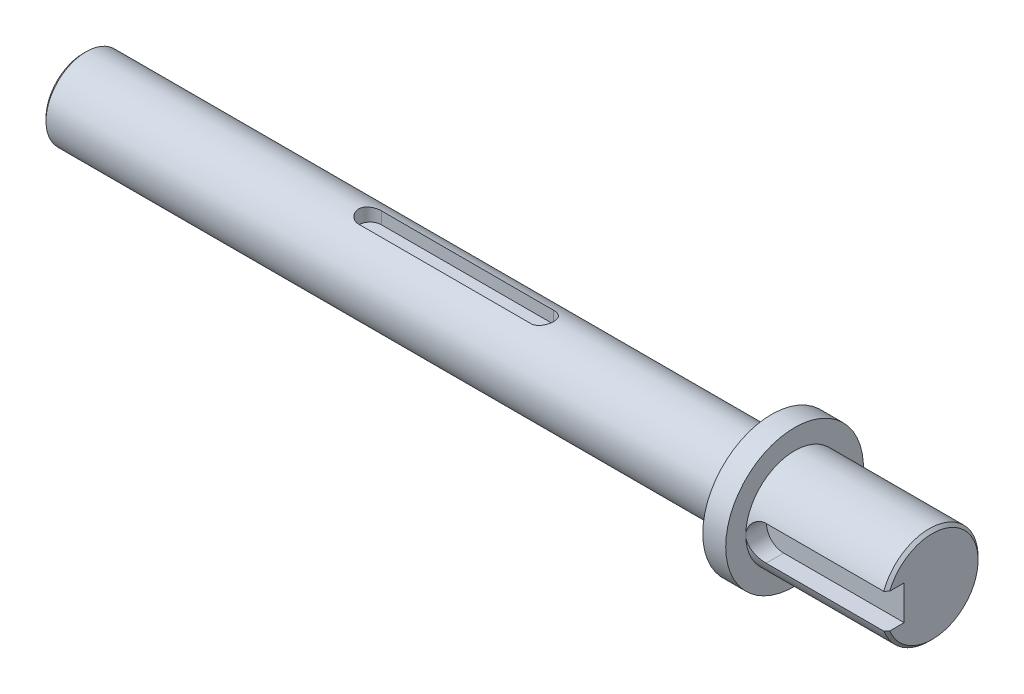
from build123d import *
from build123d.topology import SkipClean

# Parameters (mm, degrees)
SKETCH1_R            = 3.5
SHAFT_BOSS_DEPTH     = 60
CUT_2X2_KEYWAY_DEPTH = 1.2
SKETCH3_R            = 6
COLLAR_BOSS_DEPTH    = 2
SKETCH4_R            = 4.25
HANDLE_BOSS_DEPTH    = 12
CUT_3X3_KEYWAY_DEPTH = 1.8
CHAMFER1_SIZE        = 0.254


with BuildPart() as part:
    # Sketch1 → Shaft-Boss (new body)
    with BuildSketch(Plane(origin=(0, 0, 0), x_dir=(0, 0, -1), z_dir=(1, 0, 0))):
        Circle(SKETCH1_R)
    extrude(amount=SHAFT_BOSS_DEPTH)

    # Sketch2 → Cut-2x2 Keyway (cut)
    with BuildSketch(Plane(origin=(0, 3.5, 0), x_dir=(-1, 0, 0), z_dir=(0, 1, 0))):
        with BuildLine():
            Line((-25, -1), (-40, -1))
            ThreePointArc((-40, -1), (-41, 0), (-40, 1))
            Line((-40, 1), (-25, 1))
            ThreePointArc((-25, 1), (-24, 0), (-25, -1))
        make_face()
    extrude(amount=-CUT_2X2_KEYWAY_DEPTH, mode=Mode.SUBTRACT)

    # Sketch3 → Collar-Boss (add)
    with BuildSketch(Plane(origin=(60, 0, 0), x_dir=(0, 0, -1), z_dir=(1, 0, 0))):
        Circle(SKETCH3_R)
    extrude(amount=COLLAR_BOSS_DEPTH)

    # Sketch4 → Handle-Boss (add)
    with BuildSketch(Plane(origin=(62, 0, 0), x_dir=(0, 0, -1), z_dir=(1, 0, 0))):
        Circle(SKETCH4_R)
    extrude(amount=HANDLE_BOSS_DEPTH)

    # Sketch5 → Cut-3x3 Keyway (cut)
    with SkipClean():  # the faces are left unmerged after this step: merging them gives an invalid solid
        with BuildSketch(Plane.XY.offset(4.25)):
            with BuildLine():
                Line((83.5, -1.5), (63.5, -1.5))
                ThreePointArc((63.5, -1.5), (62, 0), (63.5, 1.5))
                Line((63.5, 1.5), (83.5, 1.5))
                ThreePointArc((83.5, 1.5), (85, 0), (83.5, -1.5))
            make_face()
        extrude(amount=-CUT_3X3_KEYWAY_DEPTH, mode=Mode.SUBTRACT)

    # Chamfer1
    chamfer1_edges = [part.edges().sort_by_distance(p)[0] for p in [
        (0, 0, 3.5),
        (74, -4.181064283, -0.7623657),
    ]]
    chamfer(chamfer1_edges, length=CHAMFER1_SIZE)


solid = part.part
